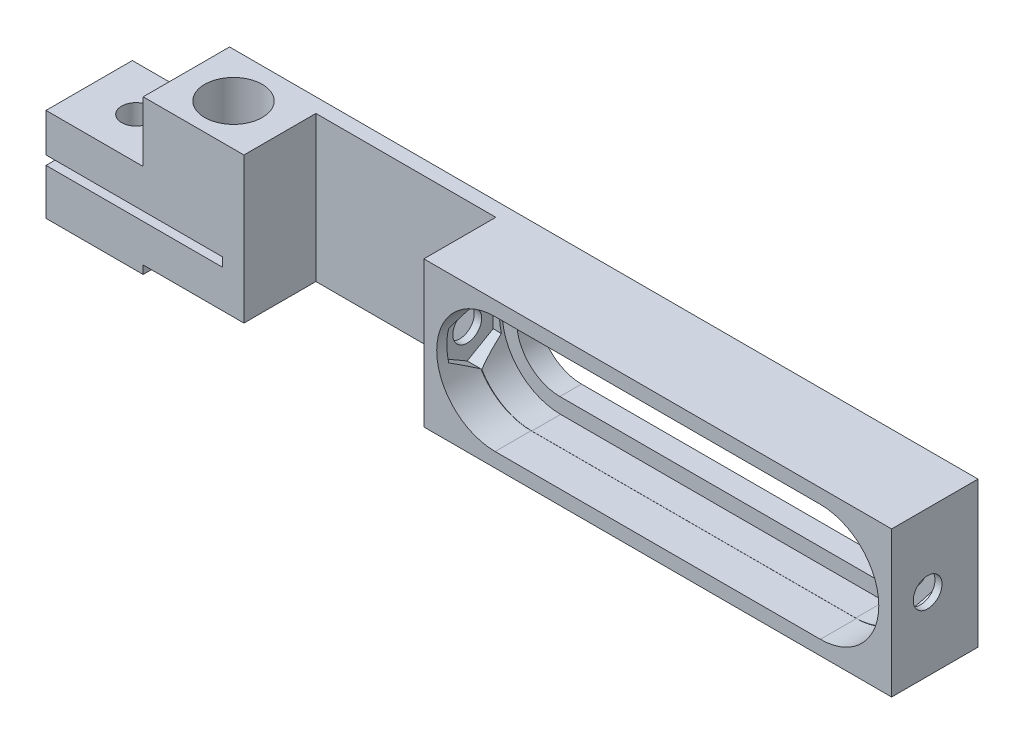
from build123d import *

# Parameters (mm, degrees)
BOSS_EXTRU_9_DEPTH            = 12
BOSS_EXTRU_10_DEPTH           = 7
BOSS_EXTRU_11_DEPTH           = 12
BOSS_EXTRU_12_DEPTH           = 2
ENL_V_MAT_EXTRU_5_DEPTH       = 102.658790864
ENL_V_MAT_EXTRU_5_DEPTH_BACK  = 102.658790864
ESQUISSE3_R                   = 4
ESQUISSE3_R_2                 = 2
ENL_V_MAT_EXTRU_6_DEPTH       = 2
ENL_V_MAT_EXTRU_13_DEPTH      = 9
ENL_V_MAT_EXTRU_15_DEPTH      = 38
ENL_V_MAT_EXTRU_15_DEPTH_BACK = 53
ESQUISSE12_R                  = 2
ENL_V_MAT_EXTRU_16_DEPTH      = 16.5
ENL_V_MAT_EXTRU_16_DEPTH_BACK = 46.5


with BuildPart() as part:
    # Esquisse1 → Boss.-Extru.9 (new body)
    with BuildSketch(Plane.XY):
        Polygon((-35.202033687, 13.574181601), (-47.527863484, 13.574181601), (-47.527863484, -6.659287984), (17.472136516, -6.659287984), (17.472136516, 13.574181601), align=None)
        with BuildLine():
            ThreePointArc((-37.62524742, -4.659287984), (-45.741982213, 3.457446809), (-37.62524742, 11.574181601))
            Line((-37.62524742, 11.574181601), (7.569520453, 11.574181601))
            ThreePointArc((7.569520453, 11.574181601), (15.686255246, 3.457446809), (7.569520453, -4.659287984))
            Line((7.569520453, -4.659287984), (-37.62524742, -4.659287984))
        make_face(mode=Mode.SUBTRACT)
    extrude(amount=BOSS_EXTRU_9_DEPTH)

    # Esquisse1<14> → Boss.-Extru.10 (add)
    with BuildSketch(Plane.XY):
        with BuildLine():
            Line((7.569520453, 11.574181601), (-37.62524742, 11.574181601))
            ThreePointArc((-37.62524742, 11.574181601), (-45.741982213, 3.457446809), (-37.62524742, -4.659287984))
            Line((-37.62524742, -4.659287984), (7.569520453, -4.659287984))
            ThreePointArc((7.569520453, -4.659287984), (15.686255246, 3.457446809), (7.569520453, 11.574181601))
        make_face()
        with BuildLine():
            ThreePointArc((-37.62524742, -2.542553191), (-43.62524742, 3.457446809), (-37.62524742, 9.457446809))
            Line((-37.62524742, 9.457446809), (7.569520453, 9.457446809))
            ThreePointArc((7.569520453, 9.457446809), (13.569520453, 3.457446809), (7.569520453, -2.542553191))
            Line((7.569520453, -2.542553191), (-37.62524742, -2.542553191))
        make_face(mode=Mode.SUBTRACT)
    extrude(amount=BOSS_EXTRU_10_DEPTH)



with BuildPart() as body_2:
    # Esquisse1<17> → Boss.-Extru.11 (new body)
    with BuildSketch(Plane.XY):
        Polygon((-72.527863484, 13.574181601), (-86.527863484, 13.574181601), (-86.527863484, 5.187945625), (-100.031251885, 5.187945625), (-100.031251885, -0.175818399), (-75.527863484, -0.175818399), (-75.527863484, -1.425818399), (-100.031251885, -1.425818399), (-100.031251885, -7.810998677), (-86.527863484, -7.810998677), (-86.527863484, -6.659287984), (-72.527863484, -6.659287984), align=None)
    extrude(amount=BOSS_EXTRU_11_DEPTH)


with BuildPart() as part_1:
    add(part.part)

    add(body_2.part)  # Boss.-Extru.12 merges body 2
    # Esquisse1<18> → Boss.-Extru.12 (add)
    with BuildSketch(Plane.XY):
        Polygon((-47.527863484, -6.659287984), (-47.527863484, 13.574181601), (-72.527863484, 13.574181601), (-72.527863484, 10.071210833), (-72.527863484, 9.071210833), (-72.527863484, -1.92773347), (-72.527863484, -2.92773347), (-72.527863484, -6.659287984), align=None)
    extrude(amount=BOSS_EXTRU_12_DEPTH)

    # Esquisse3 → Enlèv. mat.-Extru.5 (cut, two sides: drawn at the far end of the back side and taken through both)
    with BuildSketch(Plane(origin=(0, 0, 0), x_dir=(1, 0, 0), z_dir=(0, 1, 0)).offset(-ENL_V_MAT_EXTRU_5_DEPTH_BACK)):
        with Locations((-79.75826264, -6.22368636)):
            Circle(ESQUISSE3_R)
        with Locations((-93.295048271, -6.22368636)):
            Circle(ESQUISSE3_R_2)
    extrude(amount=ENL_V_MAT_EXTRU_5_DEPTH + ENL_V_MAT_EXTRU_5_DEPTH_BACK, mode=Mode.SUBTRACT)

    # Esquisse4 → Enlèv. mat.-Extru.6 (cut)
    with BuildSketch(Plane.XZ.offset(7.810998677)):
        Polygon((-91.278888912, 2.721053811), (-89.253599824, 6.218415309), (-91.269759184, 9.721047858), (-95.311207631, 9.726318909), (-97.336496718, 6.228957411), (-95.320337359, 2.726324862), align=None)
    extrude(amount=-ENL_V_MAT_EXTRU_6_DEPTH, mode=Mode.SUBTRACT)

    # Esquisse9 → Enlèv. mat.-Extru.13 (cut)
    with BuildSketch(Plane.XY.offset(12)):
        with BuildLine():
            Line((-37.527863484, 11.557446809), (7.472136516, 11.557446809))
            ThreePointArc((7.472136516, 11.557446809), (15.572136516, 3.457446809), (7.472136516, -4.642553191))
            Line((7.472136516, -4.642553191), (-37.527863484, -4.642553191))
            ThreePointArc((-37.527863484, -4.642553191), (-45.627863484, 3.457446809), (-37.527863484, 11.557446809))
        make_face()
    extrude(amount=-ENL_V_MAT_EXTRU_13_DEPTH, mode=Mode.SUBTRACT)

    # Esquisse12 → Enlèv. mat.-Extru.15 (cut, two sides: drawn at the far end of the back side and taken through both)
    with BuildSketch(Plane(origin=(0, 0, 0), x_dir=(0, 0, -1), z_dir=(1, 0, 0)).offset(-ENL_V_MAT_EXTRU_15_DEPTH_BACK)):
        with Locations((-7, 3.457446809)):
            Circle(ESQUISSE12_R)
    extrude(amount=ENL_V_MAT_EXTRU_15_DEPTH + ENL_V_MAT_EXTRU_15_DEPTH_BACK, mode=Mode.SUBTRACT)

    # Esquisse13 → Enlèv. mat.-Extru.16 (cut, two sides: drawn at the far end of the back side and taken through both)
    with BuildSketch(Plane(origin=(0, 0, 0), x_dir=(0, 0, -1), z_dir=(1, 0, 0)).offset(-ENL_V_MAT_EXTRU_16_DEPTH_BACK)):
        Polygon((-7, -0.69947513), (-3.4, 1.378985839), (-3.4, 5.535907778), (-7, 7.614368747), (-10.6, 5.535907778), (-10.6, 1.378985839), align=None)
    extrude(amount=ENL_V_MAT_EXTRU_16_DEPTH + ENL_V_MAT_EXTRU_16_DEPTH_BACK, mode=Mode.SUBTRACT)


solid = part_1.part
